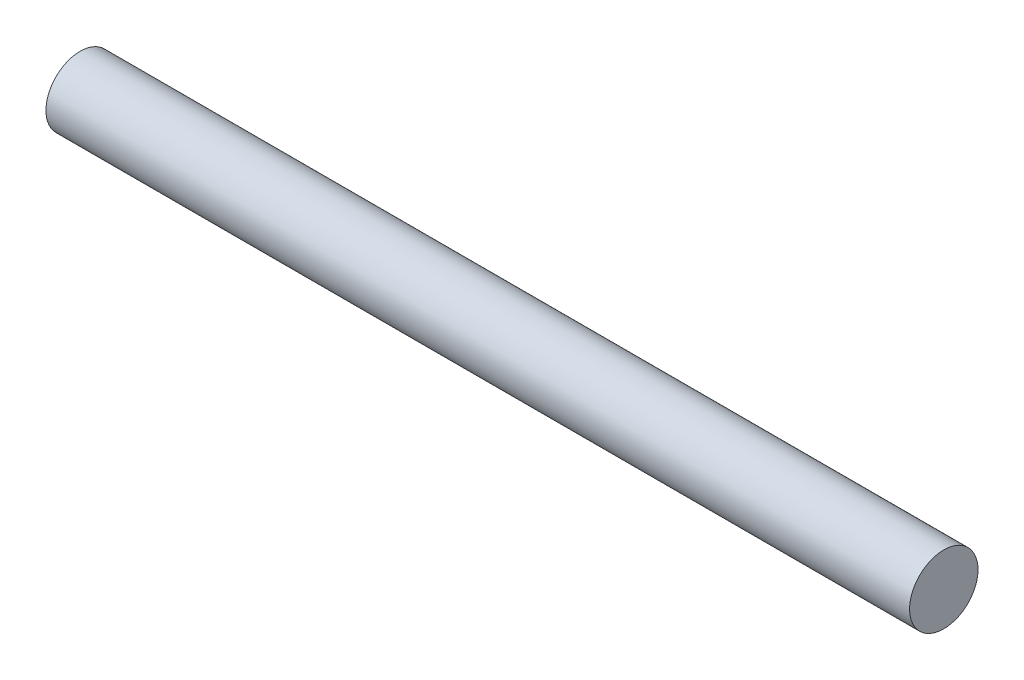
from build123d import *

# Parameters (mm, degrees)
ESQUISSE1_R        = 4
BOSS_EXTRU_1_DEPTH = 101


with BuildPart() as part:
    # Esquisse1 → Boss.-Extru.1 (new body)
    with BuildSketch(Plane(origin=(0, 0, 0), x_dir=(0, 0, -1), z_dir=(1, 0, 0))):
        with Locations((-12.47190594, -56.324056774)):
            Circle(ESQUISSE1_R)
    extrude(amount=BOSS_EXTRU_1_DEPTH)


solid = part.part
